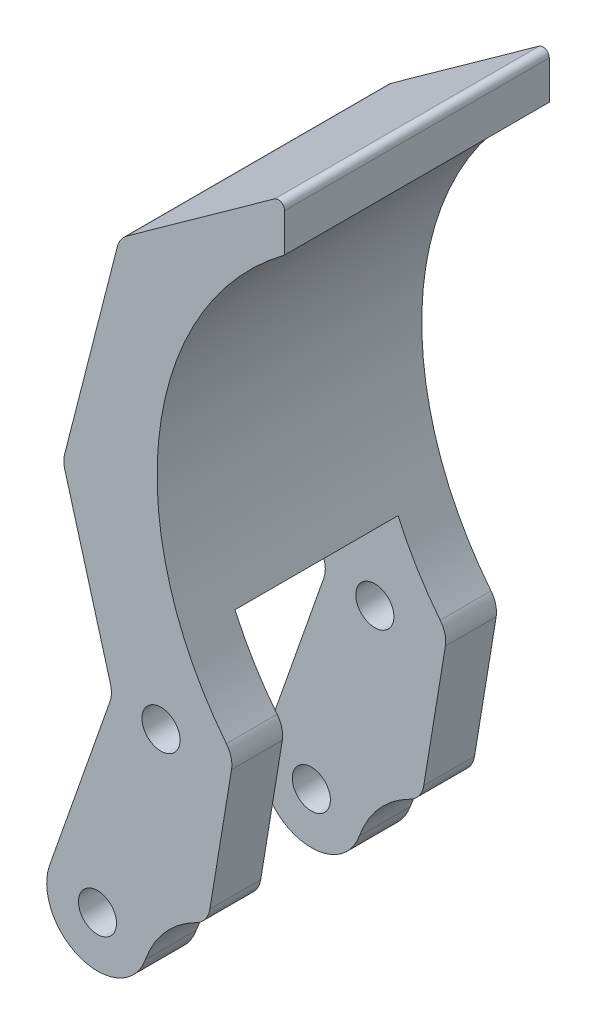
from build123d import *

# Parameters (mm, degrees)
SKETCH_1_R          = 1.5
EXTRUDE_1_DEPTH     = 4
EXTRUDE_2_DEPTH     = 20.84
EXTRUDE_START       = -4
EXTRUDE_3_DEPTH     = 4
SKETCH_8_R          = 1.5
CUT_EXTRUDE_1_DEPTH = 84.097118968


with BuildPart() as part:
    # 草图1 → 凸台-拉伸1 (new body)
    with BuildSketch(Plane.XY):
        with BuildLine():
            Line((-16.110282893, 33.654208826), (-17.814522763, 23.293438272))
            ThreePointArc((-17.814522763, 23.293438272), (-18.179793181, 22.42908037), (-18.899085656, 21.82645661))
            ThreePointArc((-18.899085656, 21.82645661), (-21.337272658, 19.958522776), (-22.891934151, 17.309568206))
            ThreePointArc((-22.891934151, 17.309568206), (-27.990948412, 14.860061819), (-30.440454799, 19.959076079))
            Line((-30.440454799, 19.959076079), (-25.681476272, 33.517536514))
            ThreePointArc((-25.681476272, 33.517536514), (-25.569637864, 34.115664062), (-25.6428361, 34.719738902))
            Line((-25.6428361, 34.719738902), (-29.24172024, 47.558366666))
            ThreePointArc((-29.24172024, 47.558366666), (-29.31581841, 48.075186607), (-29.253628902, 48.593574353))
            Line((-29.253628902, 48.593574353), (-25.108232608, 64.808221419))
            ThreePointArc((-25.108232608, 64.808221419), (-24.821945701, 65.441071196), (-24.336476636, 65.937839573))
            Line((-24.336476636, 65.937839573), (-12.719407819, 74.272976396))
            ThreePointArc((-12.719407819, 74.272976396), (-12.199607619, 74.311552327), (-11.927927269, 73.866726364))
            Line((-11.927927269, 73.866726364), (-11.927927269, 70.840856193))
            ThreePointArc((-11.927927269, 70.840856193), (-21.765630275, 54.0055336), (-16.519844581, 35.225485153))
            ThreePointArc((-16.519844581, 35.225485153), (-16.148427264, 34.483281689), (-16.110282893, 33.654208826))
        make_face()
        with Locations(Location((-26.666194475, 18.634322143, 0), (0, 0, 180))):
            Circle(SKETCH_1_R, mode=Mode.SUBTRACT)
        with Locations((-21.666194475, 33.634322143)):
            Circle(SKETCH_1_R, mode=Mode.SUBTRACT)
    extrude(amount=EXTRUDE_1_DEPTH)

    # 草图2 → 凸台-拉伸2 (add)
    with BuildSketch(Plane.XY):
        with BuildLine():
            Line((-26.773099146, 38.751829393), (-19.834575078, 40.696814845))
            ThreePointArc((-19.834575078, 40.696814845), (-21.152852216, 57.151552997), (-11.927927269, 70.840856193))
            Line((-11.927927269, 70.840856193), (-11.927927269, 73.866726364))
            ThreePointArc((-11.927927269, 73.866726364), (-12.199607619, 74.311552327), (-12.719407819, 74.272976396))
            Line((-12.719407819, 74.272976396), (-24.336476636, 65.937839573))
            ThreePointArc((-24.336476636, 65.937839573), (-24.821945701, 65.441071196), (-25.108232608, 64.808221419))
            Line((-25.108232608, 64.808221419), (-29.253628902, 48.593574353))
            ThreePointArc((-29.253628902, 48.593574353), (-29.31581841, 48.075186607), (-29.24172024, 47.558366666))
            Line((-29.24172024, 47.558366666), (-26.773099146, 38.751829393))
        make_face()
    extrude(amount=EXTRUDE_2_DEPTH)

    # 草图5 → 凸台-拉伸3 (add)
    with BuildSketch(Plane.XY.offset(20.84).offset(EXTRUDE_START)):
        with BuildLine():
            Line((-19.834575078, 40.696814845), (-26.773099146, 38.751829393))
            Line((-26.773099146, 38.751829393), (-25.6428361, 34.719738902))
            ThreePointArc((-25.6428361, 34.719738902), (-25.569637864, 34.115664062), (-25.681476272, 33.517536514))
            Line((-25.681476272, 33.517536514), (-30.440454799, 19.959076079))
            ThreePointArc((-30.440454799, 19.959076079), (-27.990948412, 14.860061819), (-22.891934151, 17.309568206))
            ThreePointArc((-22.891934151, 17.309568206), (-21.337272658, 19.958522776), (-18.899085656, 21.82645661))
            ThreePointArc((-18.899085656, 21.82645661), (-18.179793181, 22.42908037), (-17.814522763, 23.293438272))
            Line((-17.814522763, 23.293438272), (-16.110282893, 33.654208826))
            ThreePointArc((-16.110282893, 33.654208826), (-16.148427264, 34.483281689), (-16.519844581, 35.225485153))
            ThreePointArc((-16.519844581, 35.225485153), (-18.352935128, 37.854689223), (-19.834575078, 40.696814845))
        make_face()
    extrude(amount=EXTRUDE_3_DEPTH)

    # 草图8 → 切除-拉伸1 (cut, through all)
    with BuildSketch(Plane(origin=(0, 0, 0), x_dir=(-1, 0, 0), z_dir=(0, 0, -1))):
        with Locations(Location((21.666194475, 33.634322143, 0), (0, 0, 180))):
            Circle(SKETCH_8_R)
        with Locations((26.666194475, 18.634322143)):
            Circle(SKETCH_8_R)
    extrude(amount=-CUT_EXTRUDE_1_DEPTH, mode=Mode.SUBTRACT)


solid = part.part
